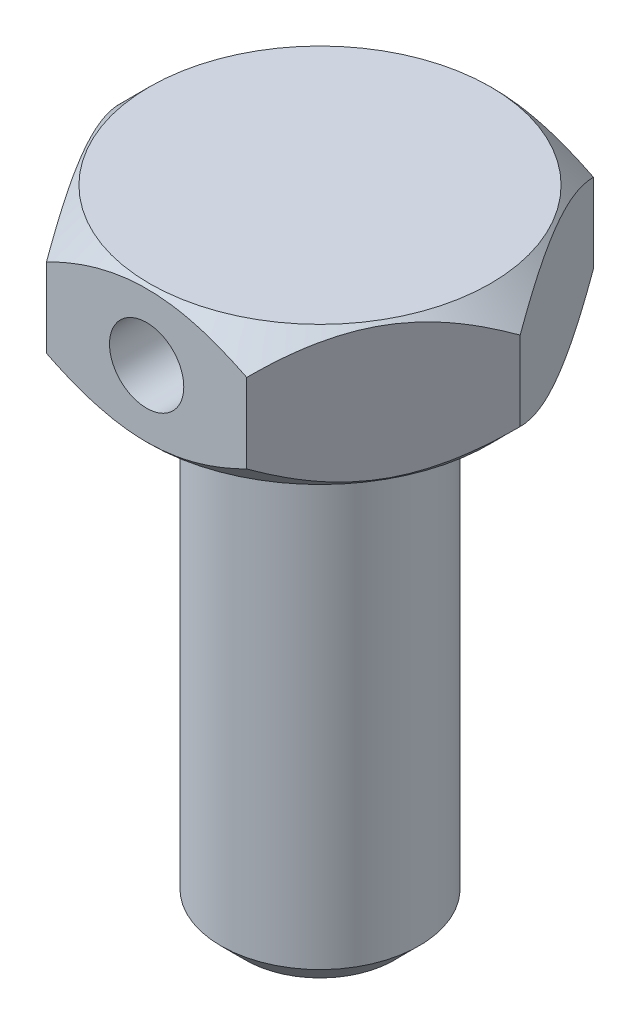
from build123d import *

# Parameters (mm, degrees)
EXTRUDE_1_DEPTH     = 2.8
SKETCH_5_R          = 2
EXTRUDE_2_DEPTH     = 10
CHAMFER_1_SIZE      = 0.5
SKETCH_6_R          = 0.75
CUT_EXTRUDE_1_DEPTH = 16.138471962


with BuildPart() as part:
    # Эскиз1 → Вытянуть1 (new body)
    with BuildSketch(Plane(origin=(0, 0, 0), x_dir=(1, 0, 0), z_dir=(0, 1, 0))):
        Polygon((-2.020725942, 3.5), (2.020725942, 3.5), (4.041451884, 0), (2.020725942, -3.5), (-2.020725942, -3.5), (-4.041451884, 0), align=None)
    extrude(amount=-EXTRUDE_1_DEPTH)

    # Эскиз5 → Вытянуть2 (add)
    with BuildSketch(Plane.XZ.offset(2.8)):
        with Locations(Location((0, 0, 0), (0, 0, 90))):
            Circle(SKETCH_5_R)
    extrude(amount=EXTRUDE_2_DEPTH)

    # Фаска1
    chamfer_1_edges = [part.edges().sort_by_distance(p)[0] for p in [
        (0, -12.8, -2),
    ]]
    chamfer(chamfer_1_edges, length=CHAMFER_1_SIZE)

    # Эскиз4 → Вырез-Повернуть1 (revolve, cut)
    with BuildSketch(Plane.XY, mode=Mode.PRIVATE) as cut_revolve_1_sk:
        Polygon((-4.041451884, -0.6), (-3.441451884, 0), (-4.041451884, 0), align=None)
        Polygon((-4.041451884, -2.2), (-3.441451884, -2.8), (-4.041451884, -2.8), align=None)
    revolve(cut_revolve_1_sk.sketch.rotate(Axis((0, -2.8, 0), (0, -1, 0)), 120.000000136), axis=Axis((0, -2.8, 0), (0, -1, 0)), mode=Mode.SUBTRACT)

    # Эскиз6 → Вырез-Вытянуть1 (cut, through all)
    with BuildSketch(Plane.XY.offset(3.5)):
        with Locations((0, -1.4)):
            Circle(SKETCH_6_R)
    extrude(amount=-CUT_EXTRUDE_1_DEPTH, mode=Mode.SUBTRACT)


solid = part.part
